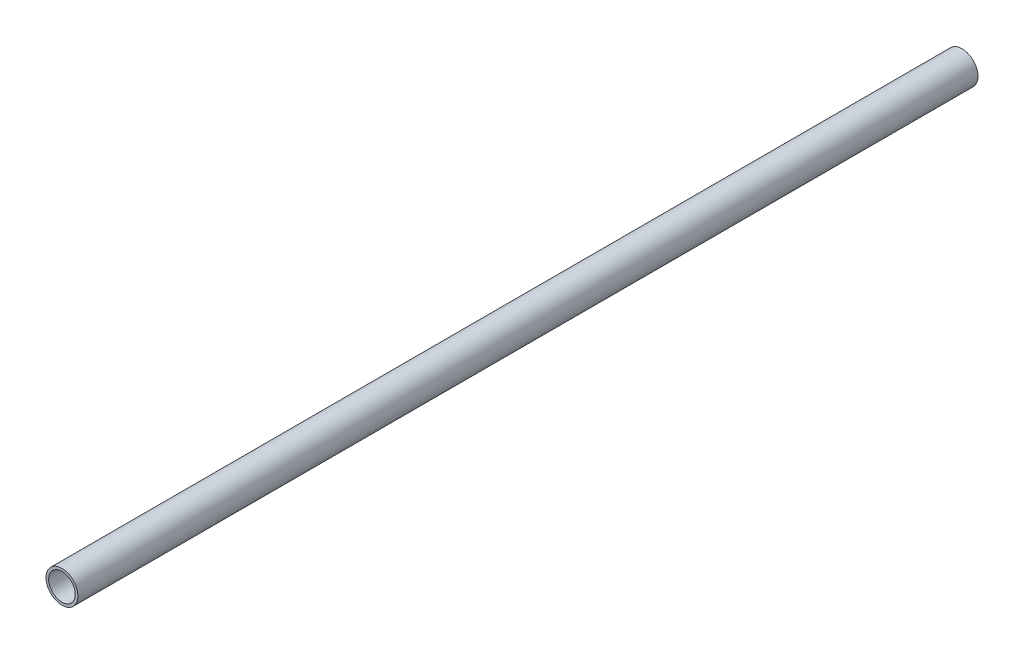
from build123d import *

# Parameters (mm, degrees)
SKETCH_1_R      = 6
SKETCH_1_R_2    = 5
EXTRUDE_1_DEPTH = 338


with BuildPart() as part:
    # 草图1 → 凸台-拉伸1 (new body)
    with BuildSketch(Plane.XY):
        Circle(SKETCH_1_R)
        Circle(SKETCH_1_R_2, mode=Mode.SUBTRACT)
    extrude(amount=EXTRUDE_1_DEPTH)


solid = part.part
